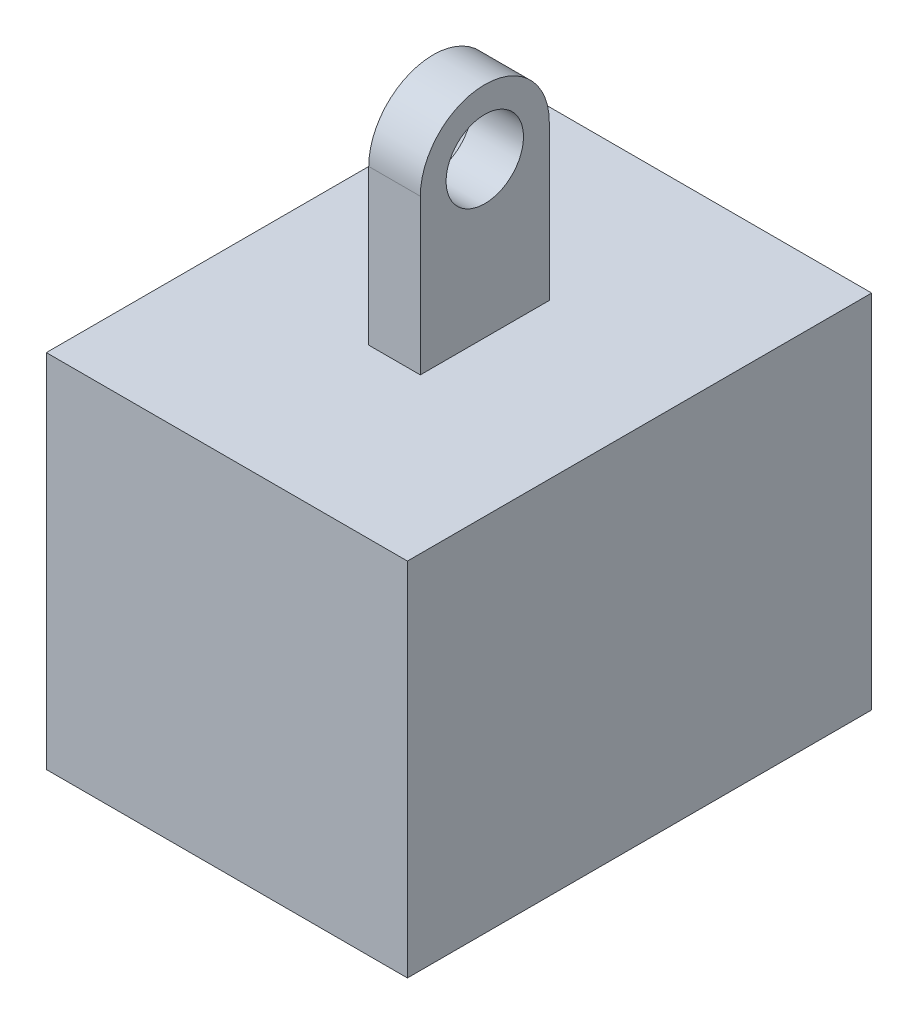
from build123d import *

# Parameters (mm, degrees)
ESQUISSE1_W             = 70
ESQUISSE1_H             = 70
BOSS_EXTRU_1_DEPTH      = 90
BOSS_EXTRU_2_DEPTH      = 5
BOSS_EXTRU_2_DEPTH_BACK = 5
ESQUISSE2_R             = 7.5


with BuildPart() as part:
    # Esquisse1 → Boss.-Extru.1 (new body)
    with BuildSketch(Plane.XY):
        Rectangle(ESQUISSE1_W, ESQUISSE1_H)
    extrude(amount=BOSS_EXTRU_1_DEPTH)

    # Esquisse2 → Boss.-Extru.2 (add, two sides: drawn at the far end of the back side and taken through both)
    with BuildSketch(Plane(origin=(0, 0, 0), x_dir=(0, 0, -1), z_dir=(1, 0, 0)).offset(-BOSS_EXTRU_2_DEPTH_BACK)):
        with BuildLine():
            Line((-57.5, 35), (-57.5, 65))
            ThreePointArc((-57.5, 65), (-45, 77.5), (-32.5, 65))
            Line((-32.5, 65), (-32.5, 35))
            Line((-32.5, 35), (-57.5, 35))
        make_face()
        with Locations((-45, 65)):
            Circle(ESQUISSE2_R, mode=Mode.SUBTRACT)
    extrude(amount=BOSS_EXTRU_2_DEPTH + BOSS_EXTRU_2_DEPTH_BACK)


solid = part.part
